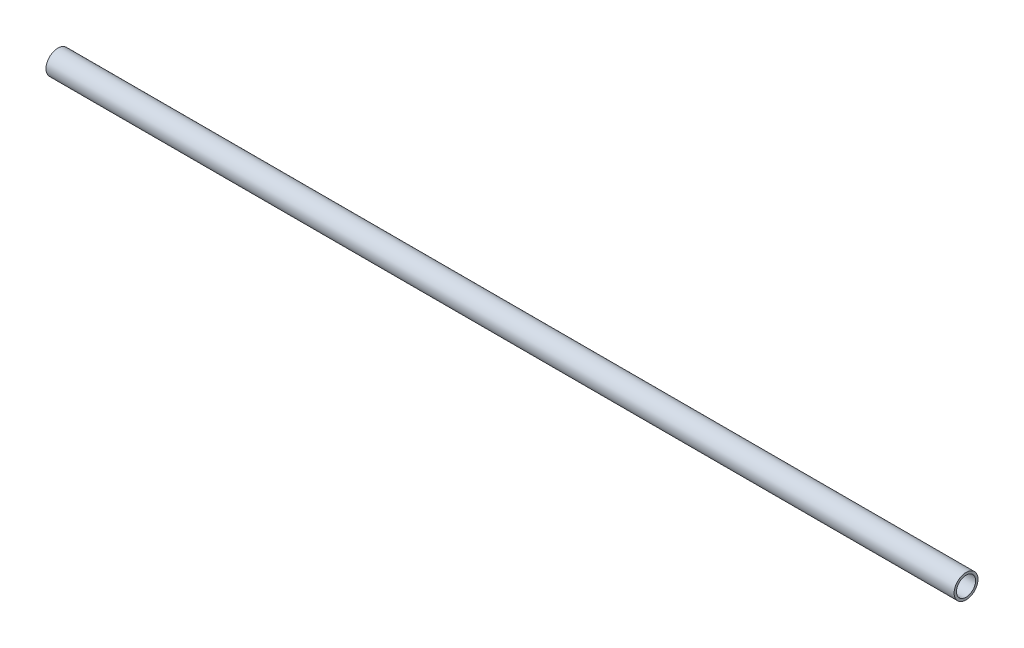
from build123d import *

# Parameters (mm, degrees)
SWEEP1_PROFILE_R     = 5
CUT_SWEEP1_PROFILE_R = 4


with BuildPart() as part:
    # Sweep1: sweep along a path in Sketch32
    with BuildLine(Plane(origin=(0, 0, 0), x_dir=(1, 0, 0), z_dir=(0, 1, 0))) as sweep1_path:
        Line((-190.132445986, -223.37896957), (190.132445986, -223.37896957))
    # Sweep1 profile (on start of the path) → Sweep1 (sweep)
    with BuildSketch(Plane(origin=(-190.132445986, 0, 223.37896957), x_dir=(0, 0, 1), z_dir=(1, 0, 0))):
        Circle(SWEEP1_PROFILE_R)
    sweep(path=sweep1_path.line)

    # Cut-Sweep1: sweep along a path in Sketch32<3>
    with BuildLine(Plane(origin=(0, 0, 0), x_dir=(1, 0, 0), z_dir=(0, 1, 0))) as cut_sweep1_path:
        Line((-190.132445986, -223.37896957), (190.132445986, -223.37896957))
    # Cut-Sweep1 profile (on start of the path) → Cut-Sweep1 (sweep, cut)
    with BuildSketch(Plane(origin=(-190.132445986, 0, 223.37896957), x_dir=(0, 0, 1), z_dir=(1, 0, 0))):
        Circle(CUT_SWEEP1_PROFILE_R)
    sweep(path=cut_sweep1_path.line, mode=Mode.SUBTRACT)


solid = part.part
